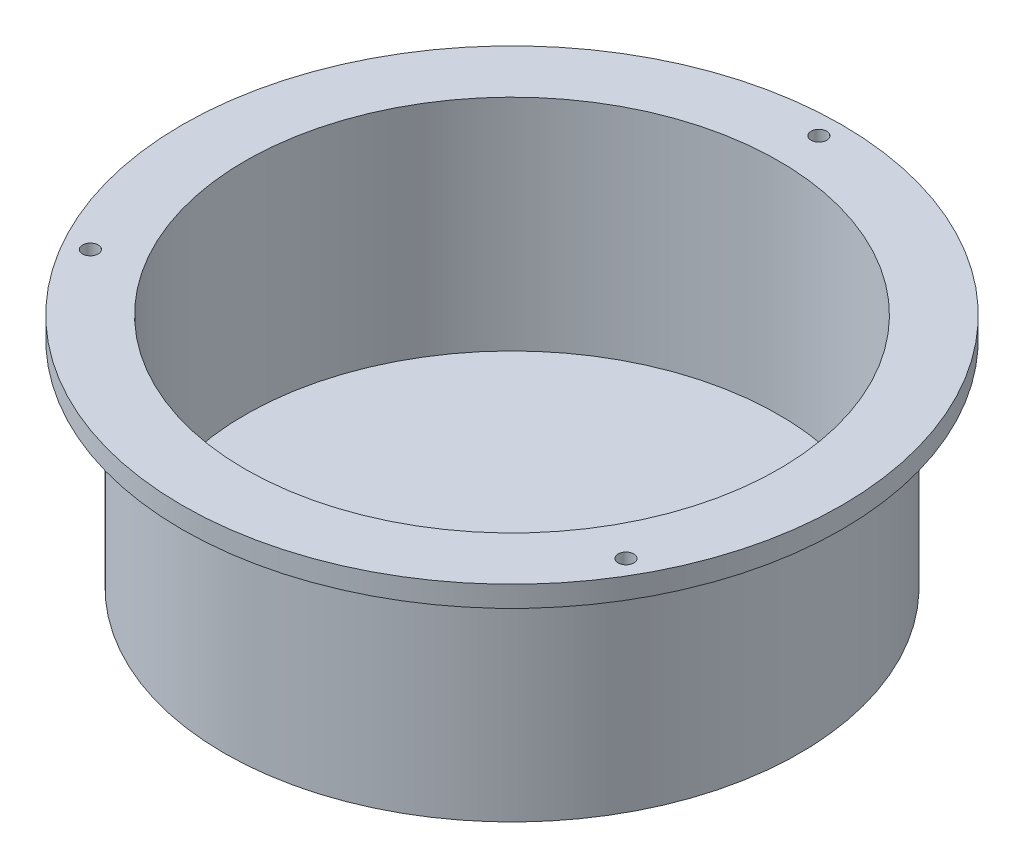
from build123d import *

# Parameters (mm, degrees)
SKETCH1_R           = 55
BOSS_EXTRUDE1_DEPTH = 41
SKETCH2_R           = 63
BOSS_EXTRUDE2_DEPTH = 4
SKETCH3_R           = 51
CUT_EXTRUDE3_DEPTH  = 42
SKETCH4_R           = 5
CUT_EXTRUDE4_DEPTH  = 3
SKETCH5_R           = 1.5
CUT_EXTRUDE5_DEPTH  = 4


with BuildPart() as part:
    # Sketch1 → Boss-Extrude1 (new body)
    with BuildSketch(Plane(origin=(0, 0, 0), x_dir=(1, 0, 0), z_dir=(0, 1, 0))):
        with Locations(Location((0, 0, 0), (0, 0, 270))):
            Circle(SKETCH1_R)
    extrude(amount=BOSS_EXTRUDE1_DEPTH)

    # Sketch2 → Boss-Extrude2 (add)
    with BuildSketch(Plane(origin=(0, 41, 0), x_dir=(1, 0, 0), z_dir=(0, 1, 0))):
        with Locations(Location((0, 0, 0), (0, 0, 270))):
            Circle(SKETCH2_R)
    extrude(amount=BOSS_EXTRUDE2_DEPTH)

    # Sketch3 → Cut-Extrude3 (cut)
    with BuildSketch(Plane(origin=(0, 45, 0), x_dir=(1, 0, 0), z_dir=(0, 1, 0))):
        with Locations(Location((0, 0, 0), (0, 0, 270))):
            Circle(SKETCH3_R)
    extrude(amount=-CUT_EXTRUDE3_DEPTH, mode=Mode.SUBTRACT)

    # Sketch4 → Cut-Extrude4 (cut)
    with BuildSketch(Plane.XZ):
        with Locations(Location((0, 0, 0), (0, 0, 270))):
            Circle(SKETCH4_R)
    extrude(amount=-CUT_EXTRUDE4_DEPTH, mode=Mode.SUBTRACT)

    # Sketch5 → Cut-Extrude5 (cut)
    with BuildSketch(Plane(origin=(0, 45, 0), x_dir=(1, 0, 0), z_dir=(0, 1, 0))):
        with Locations(Location((-0.350950897, 58.998956207, 0), (0, 0, 270))):
            Circle(SKETCH5_R)
        with Locations(Location((-51.138331167, -29.42568751, 0), (0, 0, 270))):
            Circle(SKETCH5_R)
        with Locations(Location((51.161668833, -29.385092176, 0), (0, 0, 270))):
            Circle(SKETCH5_R)
    extrude(amount=-CUT_EXTRUDE5_DEPTH, mode=Mode.SUBTRACT)


solid = part.part
